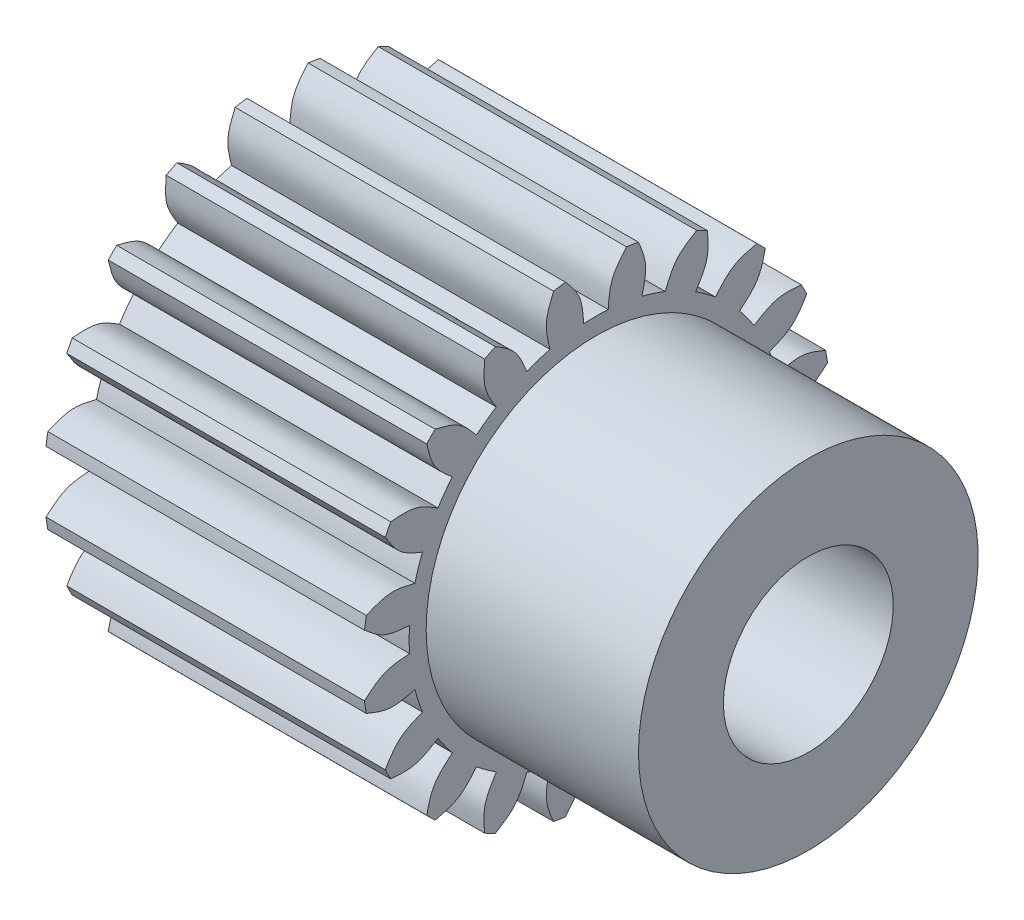
from build123d import *

# Parameters (mm, degrees)
KUGGLUCKA_DEPTH  = 15
CIRPATTERN_COUNT = 20


with BuildPart() as part:
    # Ritning 1 → Kugghjulsämne (revolve)
    with BuildSketch(Plane.XY, mode=Mode.PRIVATE) as kugghjuls_mne_sk:
        Polygon((-12.5, -1.5), (12.5, -1.5), (12.5, 2.5), (2.5, 2.5), (2.5, 5.5), (-12.5, 5.5), align=None)
    revolve(kugghjuls_mne_sk.sketch.rotate(Axis((-12.5, -5.5, 0), (1, 0, 0)), 90), axis=Axis((-12.5, -5.5, 0), (1, 0, 0)))

    # Ritning 2 → Kugglucka (cut)
    with BuildSketch(Plane.ZY.offset(12.5)):
        with BuildLine():
            Line((1.440871701, 5.405223003), (0, 6.846094704))
            Line((0, 6.846094704), (-1.440871701, 5.405223003))
            add(Edge.make_bspline(
                [(-1.440871701, 5.405223003), (-1.185324423, 5.108534399), (-0.660025794, 4.498666363), (-0.604460052, 3.694228596), (-0.575925931, 3.281133715)],
                knots=[0, 0, 0, 0, 0.486480002, 1, 1, 1, 1], degree=3))
            ThreePointArc((-0.575925931, 3.281133715), (0, 3.3), (0.575925931, 3.281133715))
            add(Edge.make_bspline(
                [(1.440871701, 5.405223003), (1.185324423, 5.108534399), (0.660025794, 4.498666363), (0.604460052, 3.694228596), (0.575925931, 3.281133715)],
                knots=[0, 0, 0, 0, 0.486480002, 1, 1, 1, 1], degree=3))
        make_face()
    kugglucka = extrude(amount=-KUGGLUCKA_DEPTH, mode=Mode.SUBTRACT)

    # CirPattern: Kugglucka ×20 about axis
    cirpattern_axis = Axis((-12.5, -5.5, 0), (-1, 0, 0))
    for i in range(1, CIRPATTERN_COUNT):
        add(kugglucka.rotate(cirpattern_axis, i * 360 / CIRPATTERN_COUNT), mode=Mode.SUBTRACT)


solid = part.part
